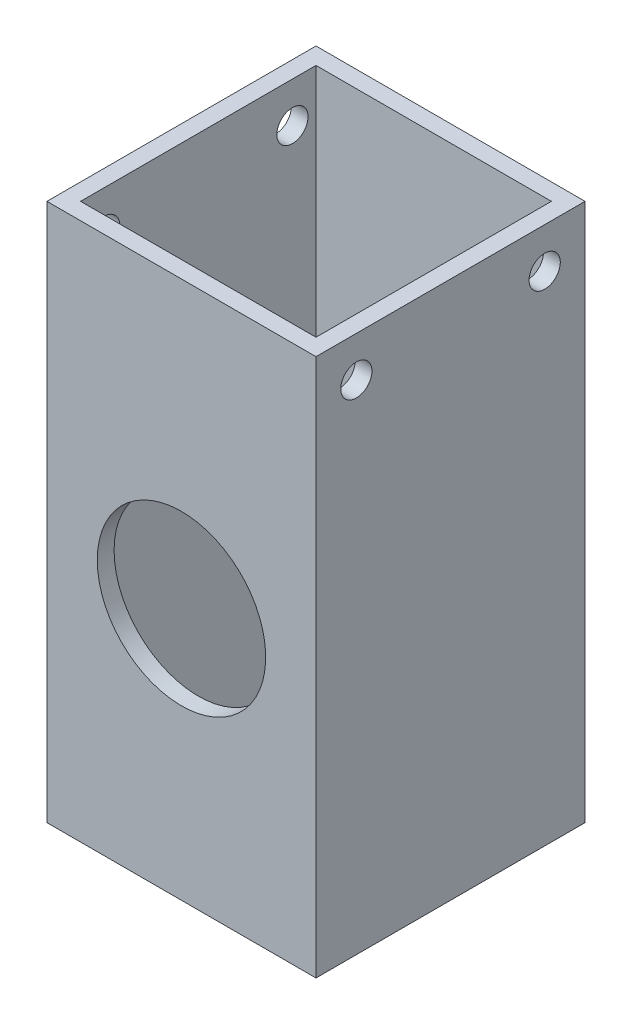
from build123d import *

# Parameters (mm, degrees)
SKETCH1_W               = 25.4
SKETCH1_H               = 25.4
SKETCH1_W_2             = 22.225
SKETCH1_H_2             = 22.225
BOSS_EXTRUDE1_DEPTH     = 50.8
CUT_EXTRUDE1_DEPTH      = 59.198711326
CUT_EXTRUDE1_DEPTH_BACK = 59.198711326
SKETCH2_R               = 7.9502
CUT_EXTRUDE2_DEPTH      = 59.198711326
CUT_EXTRUDE2_DEPTH_BACK = 59.198711326
SKETCH3_R               = 1.4732


with BuildPart() as part:
    # Sketch1 → Boss-Extrude1 (new body)
    with BuildSketch(Plane(origin=(0, 0, 0), x_dir=(1, 0, 0), z_dir=(0, 1, 0))):
        Rectangle(SKETCH1_W, SKETCH1_H)
        Rectangle(SKETCH1_W_2, SKETCH1_H_2, mode=Mode.SUBTRACT)
    extrude(amount=BOSS_EXTRUDE1_DEPTH)

    # Sketch2 → Cut-Extrude1 (cut, two sides: drawn at the far end of the back side and taken through both)
    with BuildSketch(Plane.XY.offset(12.7).offset(-CUT_EXTRUDE1_DEPTH_BACK)):
        with Locations(Location((0, 23.8506, 0), (0, 0, 180))):
            Circle(SKETCH2_R)
    extrude(amount=CUT_EXTRUDE1_DEPTH + CUT_EXTRUDE1_DEPTH_BACK, mode=Mode.SUBTRACT)

    # Sketch3 → Cut-Extrude2 (cut, two sides: drawn at the far end of the back side and taken through both)
    with BuildSketch(Plane(origin=(12.7, 0, 0), x_dir=(0, 0, -1), z_dir=(1, 0, 0)).offset(-CUT_EXTRUDE2_DEPTH_BACK)):
        with Locations((-8.89, 46.99)):
            Circle(SKETCH3_R)
        with Locations((8.89, 46.99)):
            Circle(SKETCH3_R)
    extrude(amount=CUT_EXTRUDE2_DEPTH + CUT_EXTRUDE2_DEPTH_BACK, mode=Mode.SUBTRACT)


solid = part.part
